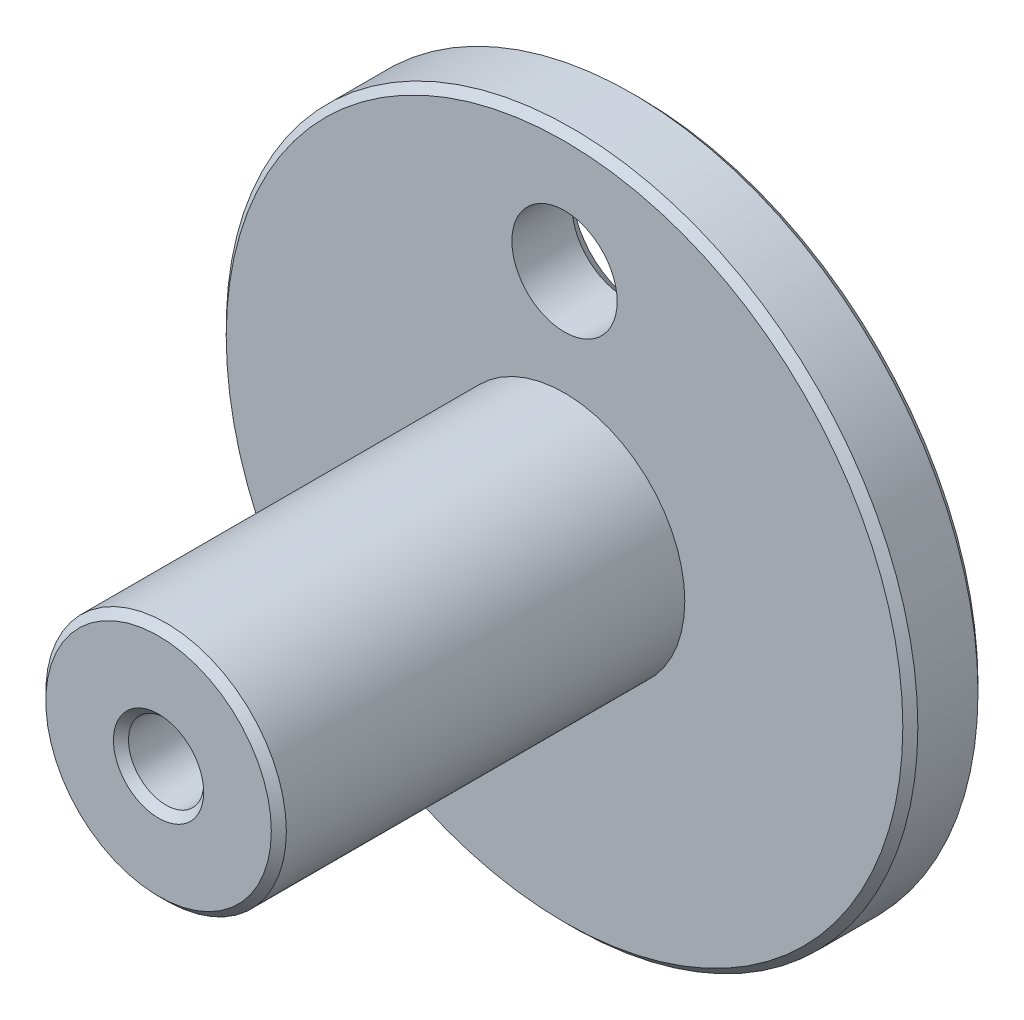
from build123d import *

# Parameters (mm, degrees)
SKETCH1_R                                           = 23
SKETCH1_R_2                                         = 8
SKETCH1_R_3                                         = 3.5
BOSS_EXTRUDE1_DEPTH                                 = 5
SKETCH1_3_R                                         = 8
BOSS_EXTRUDE2_DEPTH                                 = 32
SKETCH2_R                                           = 2.5
CUT_EXTRUDE1_DEPTH                                  = 37
CHAMFER2_SIZE                                       = 0.5
CSK_FOR_M6_COUNTERSUNK_FLAT_HEAD_SCREW2_D           = 7
CSK_FOR_M6_COUNTERSUNK_FLAT_HEAD_SCREW2_DEPTH       = 5
CSK_FOR_M6_COUNTERSUNK_FLAT_HEAD_SCREW2_CSINK_D     = 9
CSK_FOR_M6_COUNTERSUNK_FLAT_HEAD_SCREW2_CSINK_ANGLE = 90
CSK_FOR_M6_COUNTERSUNK_FLAT_HEAD_SCREW2_TIP         = 2.103012167


with BuildPart() as part:
    # Sketch1 → Boss-Extrude1 (new body)
    with BuildSketch(Plane.XY):
        Circle(SKETCH1_R)
        Circle(SKETCH1_R_2, mode=Mode.SUBTRACT)
        with Locations((0, 15)):
            Circle(SKETCH1_R_3, mode=Mode.SUBTRACT)
    extrude(amount=BOSS_EXTRUDE1_DEPTH)

    # Sketch1<3> → Boss-Extrude2 (add)
    with BuildSketch(Plane.XY):
        Circle(SKETCH1_3_R)
    extrude(amount=BOSS_EXTRUDE2_DEPTH)

    # Sketch2 → Cut-Extrude1 (cut)
    with BuildSketch(Plane.XY.offset(32)):
        Circle(SKETCH2_R)
    extrude(amount=-CUT_EXTRUDE1_DEPTH, mode=Mode.SUBTRACT)

    # Chamfer2
    chamfer2_edges = [part.edges().sort_by_distance(p)[0] for p in [
        (-8, 0, 32),
        (-2.5, 0, 32),
        (-23, 0, 0),
        (-23, 0, 5),
    ]]
    chamfer(chamfer2_edges, length=CHAMFER2_SIZE)

    # CSK for M6 Countersunk Flat Head Screw2
    with Locations(Plane(origin=(0, 0, 0), x_dir=(-1, 0, 0), z_dir=(0, 0, -1))):
        with Locations((0, 15)):
            CounterSinkHole(CSK_FOR_M6_COUNTERSUNK_FLAT_HEAD_SCREW2_D / 2, CSK_FOR_M6_COUNTERSUNK_FLAT_HEAD_SCREW2_CSINK_D / 2, depth=CSK_FOR_M6_COUNTERSUNK_FLAT_HEAD_SCREW2_DEPTH, counter_sink_angle=CSK_FOR_M6_COUNTERSUNK_FLAT_HEAD_SCREW2_CSINK_ANGLE)
            with Locations((0, 0, -(CSK_FOR_M6_COUNTERSUNK_FLAT_HEAD_SCREW2_DEPTH + CSK_FOR_M6_COUNTERSUNK_FLAT_HEAD_SCREW2_TIP / 2))):  # 118° drill point
                Cone(0, CSK_FOR_M6_COUNTERSUNK_FLAT_HEAD_SCREW2_D / 2, CSK_FOR_M6_COUNTERSUNK_FLAT_HEAD_SCREW2_TIP, mode=Mode.SUBTRACT)


solid = part.part
